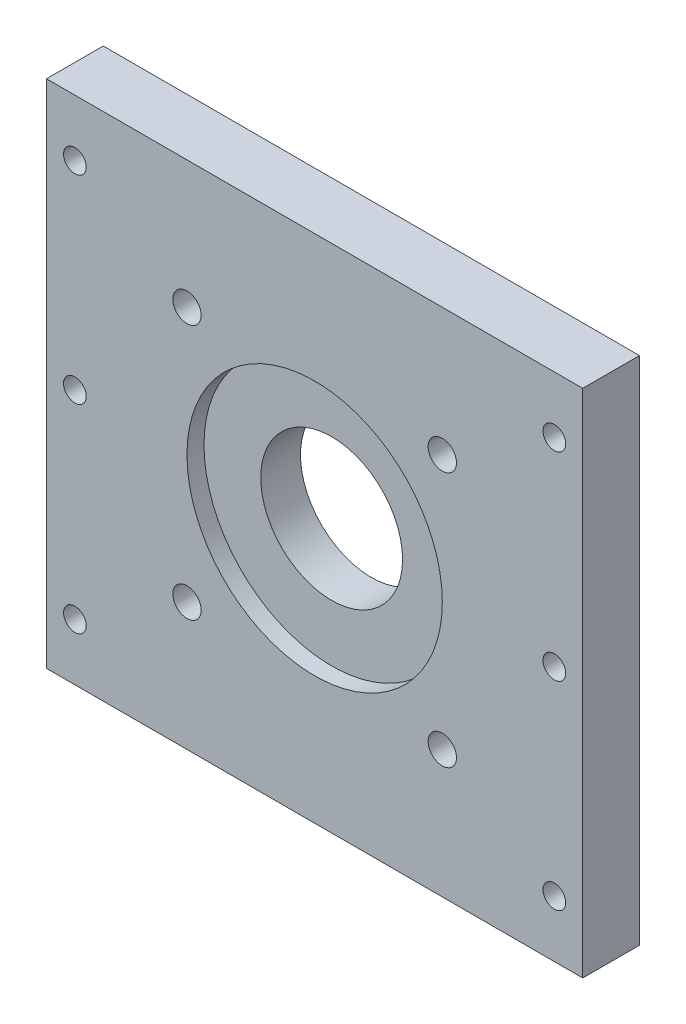
from build123d import *

# Parameters (mm, degrees)
SKETCH1_W           = 94.5
SKETCH1_H           = 90
SKETCH1_R           = 2
SKETCH1_R_2         = 2.5
SKETCH1_R_3         = 12.5
BOSS_EXTRUDE1_DEPTH = 10
SKETCH3_R           = 22.5
CUT_EXTRUDE2_DEPTH  = 3


with BuildPart() as part:
    # Sketch1 → Boss-Extrude1 (new body)
    with BuildSketch(Plane.XY):
        with Locations((47.25, 45)):
            Rectangle(SKETCH1_W, SKETCH1_H)
        with Locations((5, 80)):
            Circle(SKETCH1_R, mode=Mode.SUBTRACT)
        with Locations((5, 45)):
            Circle(SKETCH1_R, mode=Mode.SUBTRACT)
        with Locations(Location((5, 10, 0), (0, 0, 180))):
            Circle(SKETCH1_R, mode=Mode.SUBTRACT)
        with Locations((89.5, 10)):
            Circle(SKETCH1_R, mode=Mode.SUBTRACT)
        with Locations(Location((89.5, 45, 0), (0, 0, 180))):
            Circle(SKETCH1_R, mode=Mode.SUBTRACT)
        with Locations(Location((89.5, 80, 0), (0, 0, 180))):
            Circle(SKETCH1_R, mode=Mode.SUBTRACT)
        with Locations((24.75, 67.5)):
            Circle(SKETCH1_R_2, mode=Mode.SUBTRACT)
        with Locations((69.75, 67.5)):
            Circle(SKETCH1_R_2, mode=Mode.SUBTRACT)
        with Locations((69.75, 22.5)):
            Circle(SKETCH1_R_2, mode=Mode.SUBTRACT)
        with Locations((24.75, 22.5)):
            Circle(SKETCH1_R_2, mode=Mode.SUBTRACT)
        with Locations((47.25, 45)):
            Circle(SKETCH1_R_3, mode=Mode.SUBTRACT)
    extrude(amount=BOSS_EXTRUDE1_DEPTH)

    # Sketch3 → Cut-Extrude2 (cut)
    with BuildSketch(Plane.XY.offset(10)):
        with Locations((47.25, 45)):
            Circle(SKETCH3_R)
    extrude(amount=-CUT_EXTRUDE2_DEPTH, mode=Mode.SUBTRACT)


solid = part.part
